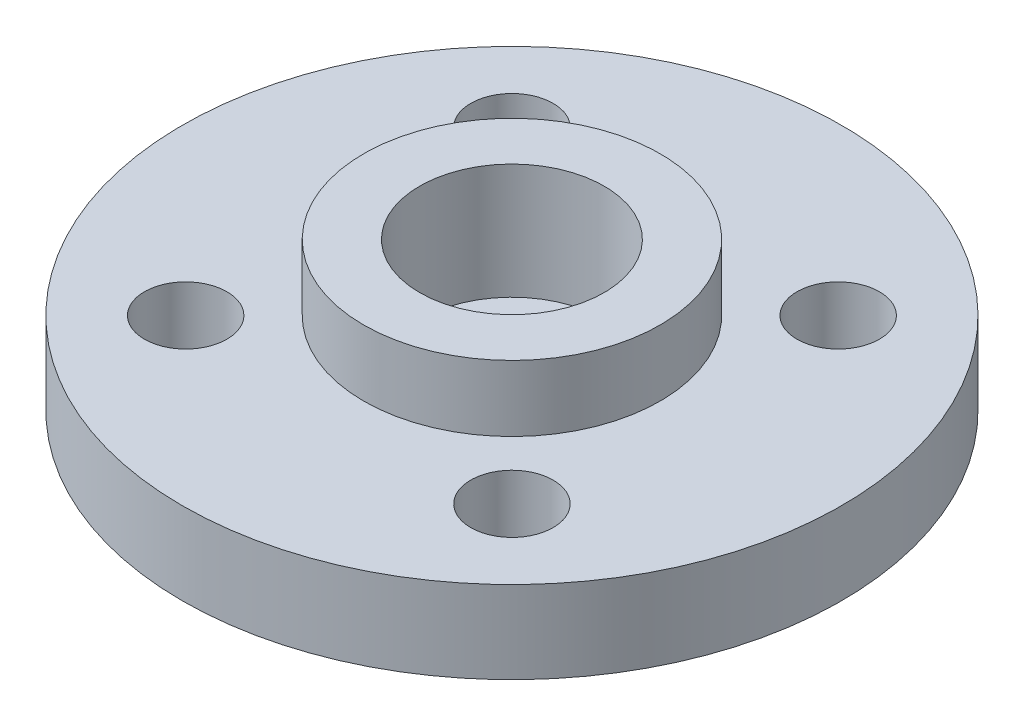
from build123d import *

# Parameters (mm, degrees)
ESQUISSE1_R                               = 10
ESQUISSE1_R_2                             = 1.6
BOSS_EXTRU_1_DEPTH                        = 2.5
ESQUISSE2_R                               = 4.5
ESQUISSE2_R_2                             = 2.8
BOSS_EXTRU_2_DEPTH                        = 2
TROU_POUR_TARAUDAGE_POUR_TROU_TARAUD_M3_D = 2.5
ENL_V_START                               = -1.5
ESQUISSE5_R                               = 2.8
ESQUISSE5_R_2                             = 1.6
ENL_V_MAT_EXTRU_1_DEPTH                   = 1.5


with BuildPart() as part:
    # Esquisse1 → Boss.-Extru.1 (new body)
    with BuildSketch(Plane(origin=(0, 0, 0), x_dir=(1, 0, 0), z_dir=(0, 1, 0))):
        with Locations(Location((0, 0, 0), (0, 0, 270))):
            Circle(ESQUISSE1_R)
        with Locations(Location((0, 0, 0), (0, 0, 270))):
            Circle(ESQUISSE1_R_2, mode=Mode.SUBTRACT)
    extrude(amount=BOSS_EXTRU_1_DEPTH)

    # Esquisse2 → Boss.-Extru.2 (add)
    with BuildSketch(Plane(origin=(0, 2.5, 0), x_dir=(1, 0, 0), z_dir=(0, 1, 0))):
        with Locations(Location((0, 0, 0), (0, 0, 270))):
            Circle(ESQUISSE2_R)
        with Locations(Location((0, 0, 0), (0, 0, 270))):
            Circle(ESQUISSE2_R_2, mode=Mode.SUBTRACT)
    extrude(amount=BOSS_EXTRU_2_DEPTH)

    # Trou pour taraudage pour trou taraudé M31 (through all)
    with Locations(Plane(origin=(0, 2.5, 0), x_dir=(1, 0, 0), z_dir=(0, 1, 0))):
        with Locations((4.949747468, -4.949747468), (-4.949747468, -4.949747468), (-4.949747468, 4.949747468), (4.949747468, 4.949747468)):
            Hole(TROU_POUR_TARAUDAGE_POUR_TROU_TARAUD_M3_D / 2)

    # Esquisse5 → Enlèv. mat.-Extru.1 (cut)
    with BuildSketch(Plane(origin=(0, 2.5, 0), x_dir=(1, 0, 0), z_dir=(0, 1, 0)).offset(ENL_V_START)):
        with Locations(Location((0, 0, 0), (0, 0, 270))):
            Circle(ESQUISSE5_R)
        with Locations(Location((0, 0, 0), (0, 0, 270))):
            Circle(ESQUISSE5_R_2, mode=Mode.SUBTRACT)
    extrude(amount=ENL_V_MAT_EXTRU_1_DEPTH, mode=Mode.SUBTRACT)


solid = part.part
